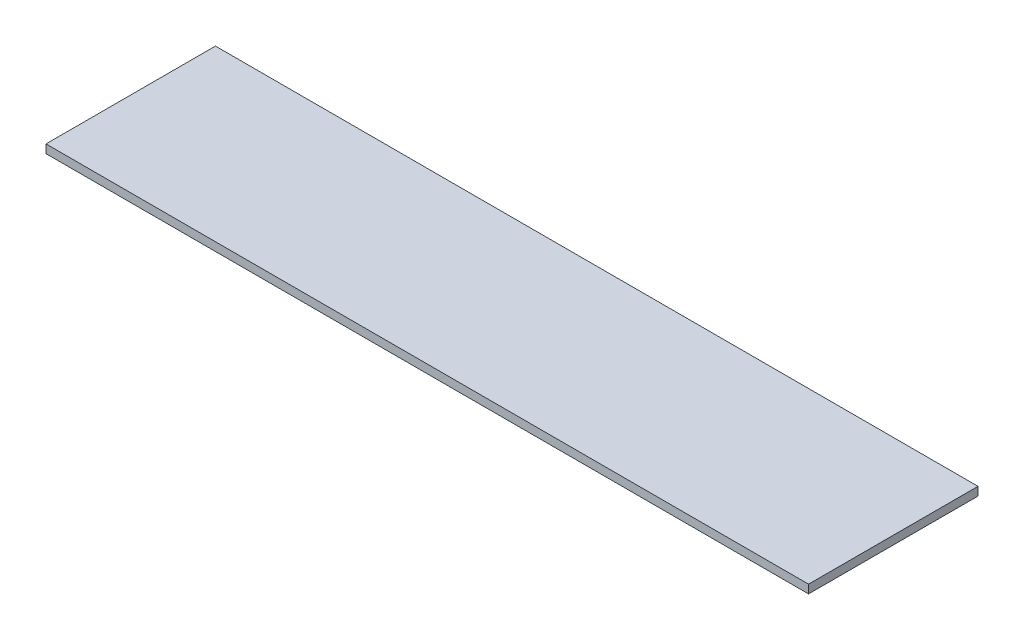
from build123d import *

# Parameters (mm, degrees)
ESQUISSE1_W        = 900
ESQUISSE1_H        = 200
BOSS_EXTRU_1_DEPTH = 10


with BuildPart() as part:
    # Esquisse1 → Boss.-Extru.1 (new body)
    with BuildSketch(Plane(origin=(0, 0, 0), x_dir=(1, 0, 0), z_dir=(0, 1, 0))):
        with Locations((450, 0)):
            Rectangle(ESQUISSE1_W, ESQUISSE1_H)
    extrude(amount=BOSS_EXTRU_1_DEPTH)


solid = part.part
